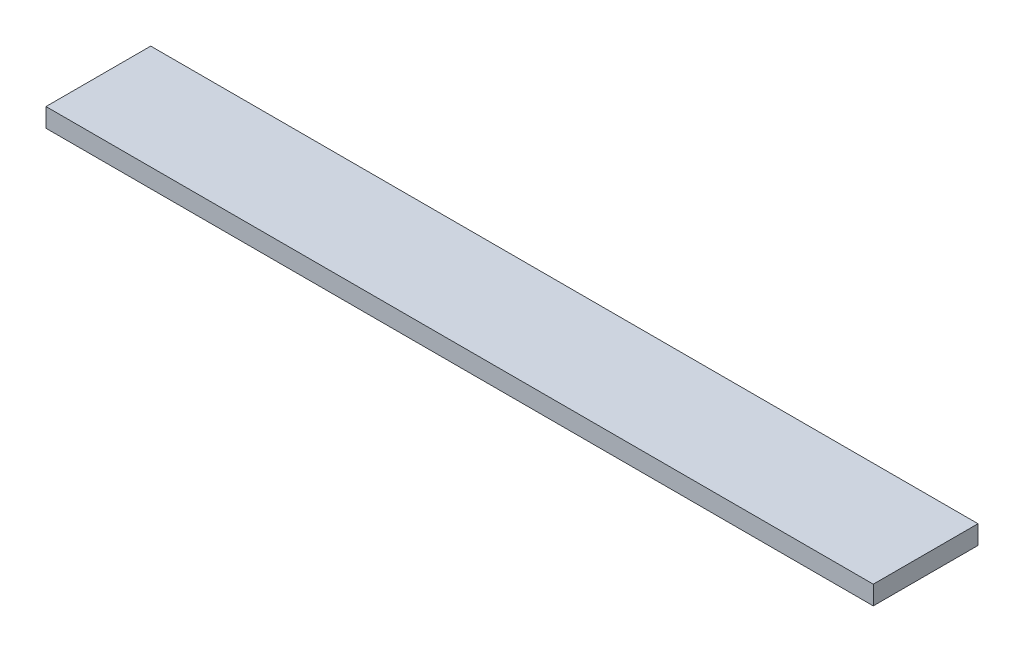
from build123d import *

# Parameters (mm, degrees)
SKETCH1_W           = 790
SKETCH1_H           = 100
BOSS_EXTRUDE1_DEPTH = 18


with BuildPart() as part:
    # Sketch1 → Boss-Extrude1 (new body)
    with BuildSketch(Plane(origin=(0, 0, 0), x_dir=(1, 0, 0), z_dir=(0, 1, 0))):
        Rectangle(SKETCH1_W, SKETCH1_H)
    extrude(amount=BOSS_EXTRUDE1_DEPTH)


solid = part.part
